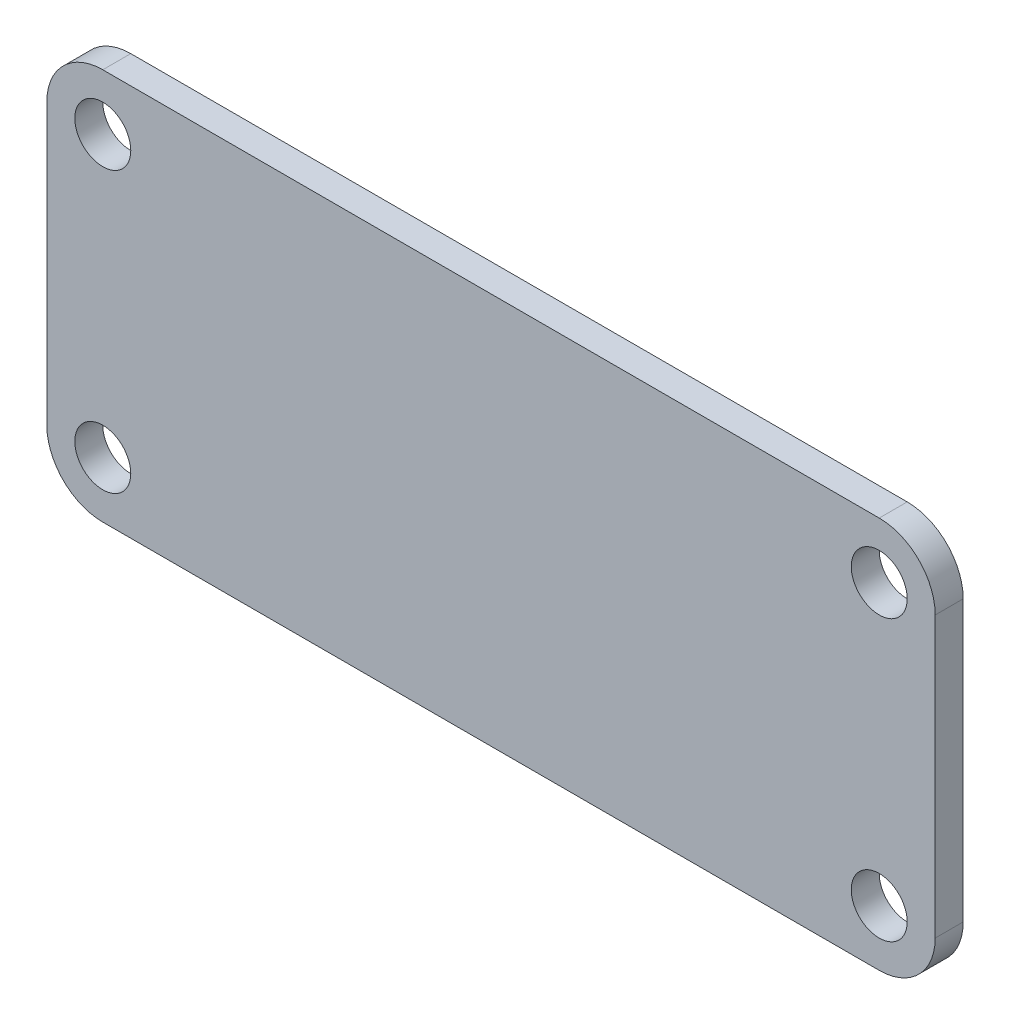
from build123d import *

# Parameters (mm, degrees)
SKETCH_1_R      = 10
EXTRUDE_1_DEPTH = 10


with BuildPart() as part:
    # 草图1 → 凸台-拉伸1 (new body)
    with BuildSketch(Plane.XY):
        with BuildLine():
            Line((-138.745, 70), (138.745, 70))
            ThreePointArc((138.745, 70), (152.887135624, 64.142135624), (158.745, 50))
            Line((158.745, 50), (158.745, -50))
            ThreePointArc((158.745, -50), (152.887135624, -64.142135624), (138.745, -70))
            Line((138.745, -70), (-138.745, -70))
            ThreePointArc((-138.745, -70), (-152.887135624, -64.142135624), (-158.745, -50))
            Line((-158.745, -50), (-158.745, 50))
            ThreePointArc((-158.745, 50), (-152.887135624, 64.142135624), (-138.745, 70))
        make_face()
        with Locations((-138.745, 50)):
            Circle(SKETCH_1_R, mode=Mode.SUBTRACT)
        with Locations((-138.745, -50)):
            Circle(SKETCH_1_R, mode=Mode.SUBTRACT)
        with Locations((138.745, -50)):
            Circle(SKETCH_1_R, mode=Mode.SUBTRACT)
        with Locations((138.745, 50)):
            Circle(SKETCH_1_R, mode=Mode.SUBTRACT)
    extrude(amount=EXTRUDE_1_DEPTH)


solid = part.part
